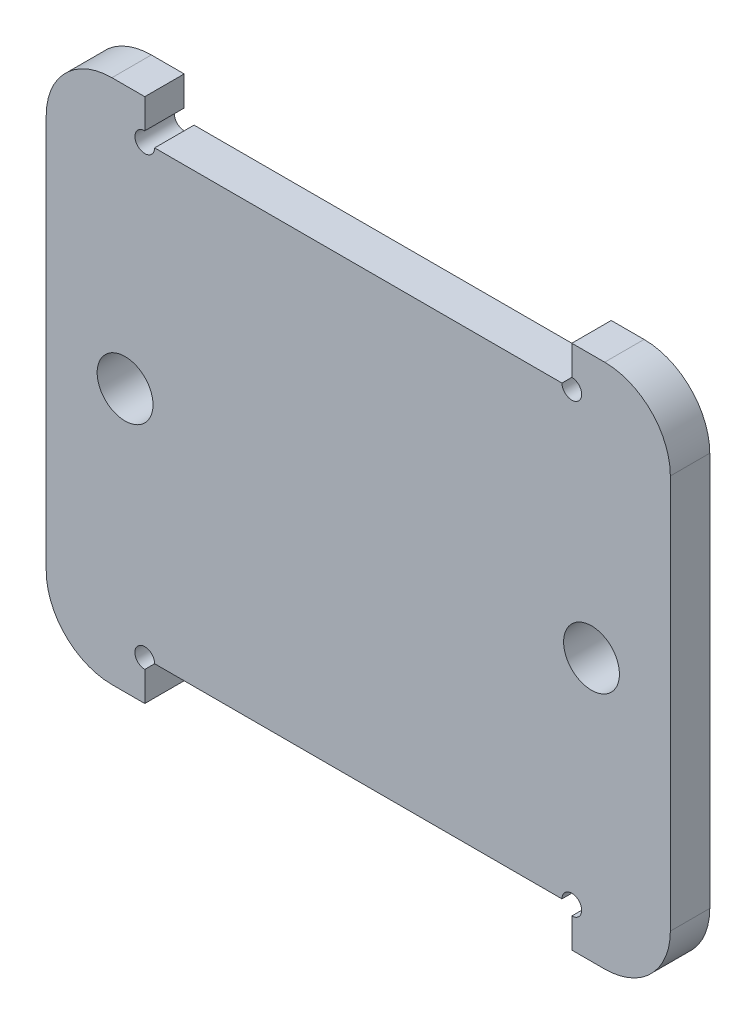
from build123d import *

# Parameters (mm, degrees)
SKETCH2_R           = 4.25
BOSS_EXTRUDE1_DEPTH = 6
FILLET1_R           = 10


with BuildPart() as part:
    # Sketch2 → Boss-Extrude1 (new body)
    with BuildSketch(Plane.XY):
        with BuildLine():
            Line((-47.5, -40), (-32.5, -40))
            Line((-32.5, -40), (-32.5, -35.5))
            ThreePointArc((-32.5, -35.5), (-33.560660172, -32.939339828), (-31, -34))
            Line((-31, -34), (31, -34))
            ThreePointArc((31, -34), (33.560660172, -32.939339828), (32.5, -35.5))
            Line((32.5, -35.5), (32.5, -40))
            Line((32.5, -40), (47.5, -40))
            Line((47.5, -40), (47.5, 40))
            Line((47.5, 40), (32.5, 40))
            Line((32.5, 40), (32.5, 35.5))
            ThreePointArc((32.5, 35.5), (33.560660172, 32.939339828), (31, 34))
            Line((31, 34), (-31, 34))
            ThreePointArc((-31, 34), (-33.560660172, 32.939339828), (-32.5, 35.5))
            Line((-32.5, 35.5), (-32.5, 40))
            Line((-32.5, 40), (-47.5, 40))
            Line((-47.5, 40), (-47.5, -40))
        make_face()
        with Locations((-35.5, 0)):
            Circle(SKETCH2_R, mode=Mode.SUBTRACT)
        with Locations(Location((35.5, 0, 0), (0, 0, 180))):
            Circle(SKETCH2_R, mode=Mode.SUBTRACT)
    extrude(amount=BOSS_EXTRUDE1_DEPTH)

    # Fillet1
    fillet1_edges = [part.edges().sort_by_distance(p)[0] for p in [
        (47.5, 40, 3),
        (47.5, -40, 3),
        (-47.5, -40, 3),
        (-47.5, 40, 3),
    ]]
    fillet(fillet1_edges, radius=FILLET1_R)


solid = part.part
